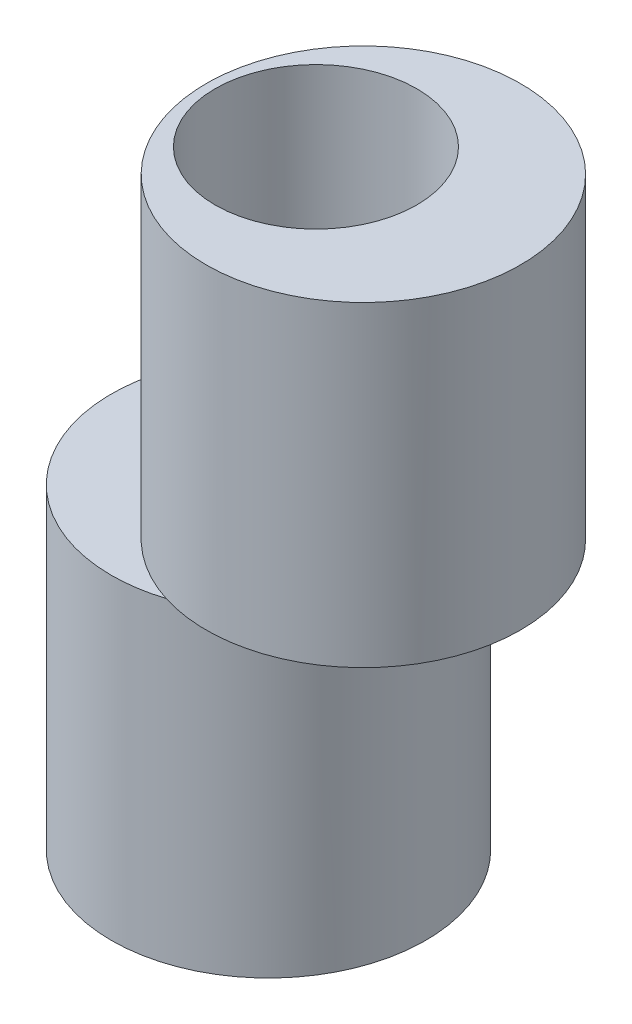
from build123d import *

# Parameters (mm, degrees)
SKETCH1_R               = 3.975
BOSS_EXTRUDE1_DEPTH     = 8
SKETCH1_3_R             = 3.975
BOSS_EXTRUDE2_DEPTH     = 8
CUT_EXTRUDE1_DEPTH      = 8
CUT_EXTRUDE1_DEPTH_BACK = 8
SKETCH1_5_R             = 2.55


with BuildPart() as part:
    # Sketch1 → Boss-Extrude1 (new body)
    with BuildSketch(Plane(origin=(0, 0, 0), x_dir=(1, 0, 0), z_dir=(0, 1, 0))):
        with Locations(Location((0, 0, 0), (0, 0, 270))):
            Circle(SKETCH1_R)
    extrude(amount=BOSS_EXTRUDE1_DEPTH)

    # Sketch1<3> → Boss-Extrude2 (add)
    with BuildSketch(Plane(origin=(0, 0, 0), x_dir=(1, 0, 0), z_dir=(0, 1, 0))):
        with Locations(Location((-2.4, 0, 0), (0, 0, 270))):
            Circle(SKETCH1_3_R)
    extrude(amount=-BOSS_EXTRUDE2_DEPTH)

    # Sketch1<5> → Cut-Extrude1 (cut, two sides: drawn at the far end of the back side and taken through both)
    with BuildSketch(Plane(origin=(0, 0, 0), x_dir=(1, 0, 0), z_dir=(0, 1, 0)).offset(-CUT_EXTRUDE1_DEPTH_BACK)):
        with Locations(Location((-1.2, 0, 0), (0, 0, 270))):
            Circle(SKETCH1_5_R)
    extrude(amount=CUT_EXTRUDE1_DEPTH + CUT_EXTRUDE1_DEPTH_BACK, mode=Mode.SUBTRACT)


solid = part.part
